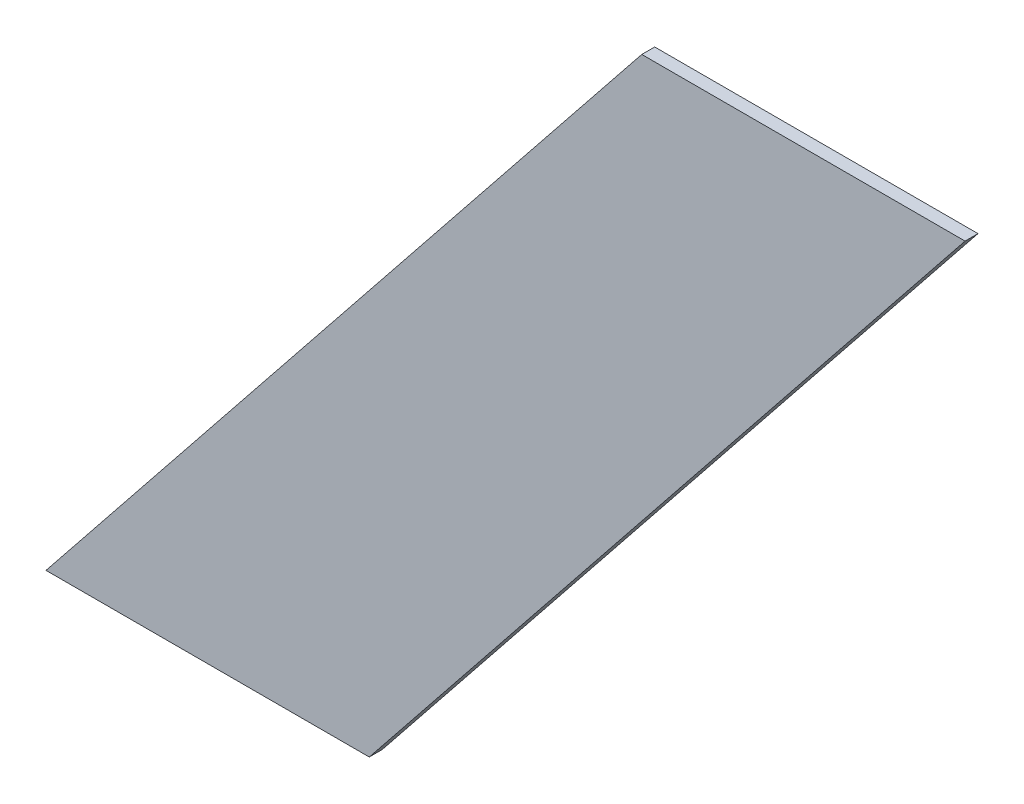
from build123d import *

# Parameters (mm, degrees)
BOSS_EXTRUDE1_DEPTH = 2.032


with BuildPart() as part:
    # Sketch2 → Boss-Extrude1 (new body)
    with BuildSketch(Plane.XY):
        Polygon((0, 0), (93.617191448, 117.020686485), (144.417191448, 117.020686485), (50.8, 0), align=None)
    extrude(amount=BOSS_EXTRUDE1_DEPTH)


solid = part.part
